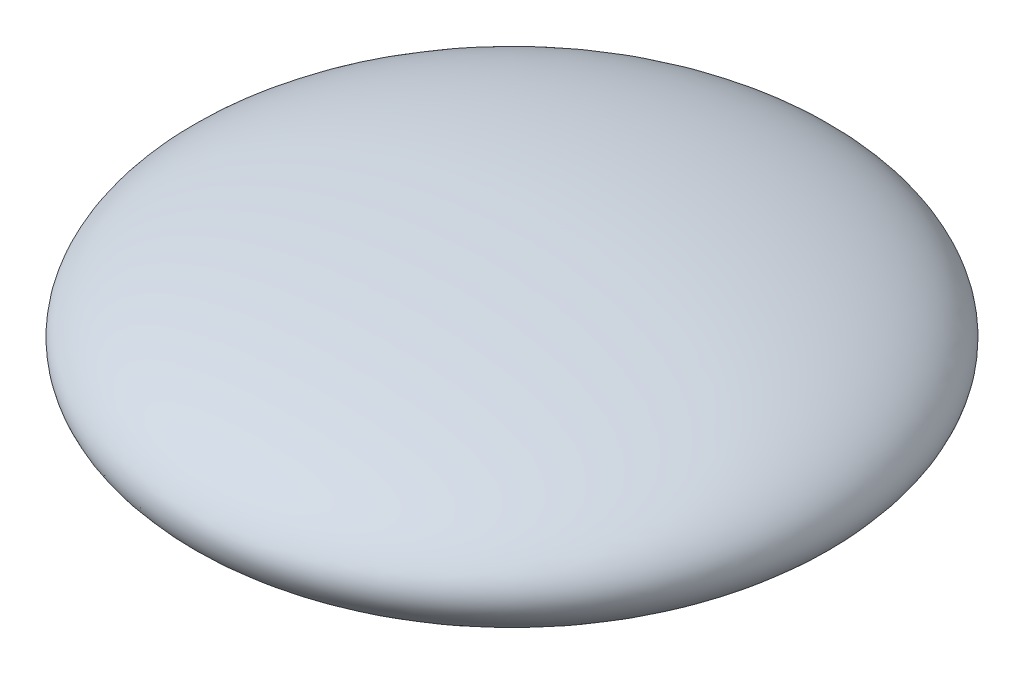
from build123d import *


with BuildPart() as part:
    # Sketch1 → Revolve1 (revolve)
    with BuildSketch(Plane.XY, mode=Mode.PRIVATE) as revolve1_sk:
        with BuildLine():
            Line((0, 14.3), (0, 0))
            Line((0, 0), (14.85, 0))
            Line((14.85, 0), (21.732978317, 3.5))
            add(Edge.make_bspline(
                [(21.732978317, 3.5), (42.971882839, 14.3), (0, 14.3)],
                knots=[5.766212054, 5.766212054, 5.766212054, 7.853981634, 7.853981634, 7.853981634], degree=2, weights=[1, 0.502866187, 1]))
        make_face()
    revolve(revolve1_sk.sketch.rotate(Axis((0, 14.3, 0), (0, -1, 0)), 180), axis=Axis((0, 14.3, 0), (0, -1, 0)))


solid = part.part
